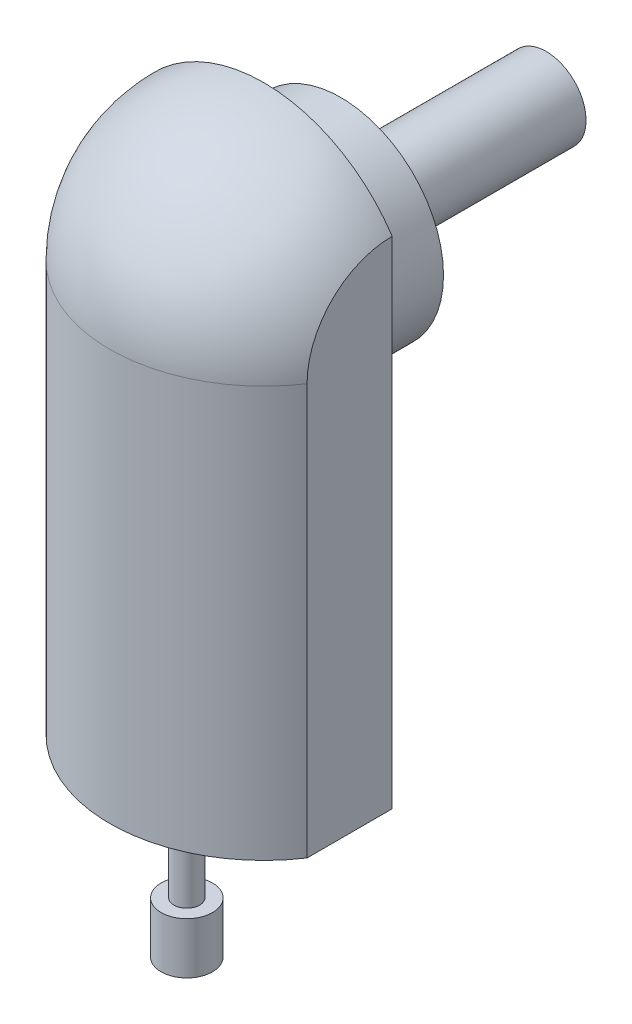
from build123d import *

# Parameters (mm, degrees)
SKETCH1_R           = 50.8
BOSS_EXTRUDE1_DEPTH = 38.1
REVOLVE1_ANGLE      = 180
BOSS_EXTRUDE2_DEPTH = 203.2
SKETCH5_W           = 76.2
SKETCH5_H           = 279.4
CUT_EXTRUDE1_DEPTH  = 12.7
SKETCH6_R           = 19.704792108
BOSS_EXTRUDE3_DEPTH = 101.6
SKETCH7_R           = 6.35
BOSS_EXTRUDE4_DEPTH = 50.8
SKETCH8_R           = 12.7
BOSS_EXTRUDE5_DEPTH = 25.4
CUT_EXTRUDE2_DEPTH  = 12.7


with BuildPart() as part:
    # Sketch1 → Boss-Extrude1 (new body)
    with BuildSketch(Plane.XY):
        with Locations(Location((0, 0, 0), (0, 0, 180))):
            Circle(SKETCH1_R)
    extrude(amount=BOSS_EXTRUDE1_DEPTH)

    # Sketch2 → Revolve1 (revolve)
    with BuildSketch(Plane.XY.offset(38.1)):
        with BuildLine():
            Line((0, 76.2), (0, -76.2))
            ThreePointArc((0, -76.2), (76.2, 0), (0, 76.2))
        make_face()
    revolve(axis=Axis((0, 76.2, 38.1), (0, -1, 0)), revolution_arc=REVOLVE1_ANGLE)

    # Sketch3 → Boss-Extrude2 (add)
    with BuildSketch(Plane(origin=(0, 0, 0), x_dir=(1, 0, 0), z_dir=(0, 1, 0))):
        with BuildLine():
            Line((-76.2, -38.1), (76.2, -38.1))
            ThreePointArc((76.2, -38.1), (0, -114.3), (-76.2, -38.1))
        make_face()
    extrude(amount=-BOSS_EXTRUDE2_DEPTH)

    # Sketch5 → Cut-Extrude1 (cut)
    with BuildSketch(Plane(origin=(76.2, 0, 0), x_dir=(0, 0, -1), z_dir=(1, 0, 0))):
        with Locations((-76.2, -63.5)):
            Rectangle(SKETCH5_W, SKETCH5_H)
    cut_extrude1 = extrude(amount=-CUT_EXTRUDE1_DEPTH, mode=Mode.SUBTRACT)

    # Mirror1: Cut-Extrude1 across plane
    add(cut_extrude1.mirror(Plane(origin=(0, 0, 0), x_dir=(0, 0, 1), z_dir=(1, 0, 0))), mode=Mode.SUBTRACT)

    # Sketch6 → Boss-Extrude3 (add)
    with BuildSketch(Plane(origin=(0, 0, 0), x_dir=(-1, 0, 0), z_dir=(0, 0, -1))):
        Circle(SKETCH6_R)
    extrude(amount=BOSS_EXTRUDE3_DEPTH)

    # Sketch7 → Boss-Extrude4 (add)
    with BuildSketch(Plane.XZ.offset(203.2)):
        with Locations(Location((0, 76.2, 0), (0, 0, 270))):
            Circle(SKETCH7_R)
    extrude(amount=BOSS_EXTRUDE4_DEPTH)

    # Sketch8 → Boss-Extrude5 (add)
    with BuildSketch(Plane.XZ.offset(254)):
        with Locations(Location((0, 76.2, 0), (0, 0, 270))):
            Circle(SKETCH8_R)
    extrude(amount=BOSS_EXTRUDE5_DEPTH)

    # Sketch9 → Cut-Extrude2 (cut)
    with BuildSketch(Plane.XZ.offset(279.4)):
        with BuildLine():
            Line((0, 83.631744278), (0, 85.853587437))
            ThreePointArc((0, 85.853587437), (-4.437705251, 84.773127931), (-7.882046977, 81.773606182))
            Line((-7.882046977, 81.773606182), (-6.067936702, 80.490800298))
            ThreePointArc((-6.067936702, 80.490800298), (-3.416335204, 82.799960363), (0, 83.631744278))
        make_face()
        with BuildLine():
            Line((6.067936702, 80.490800298), (7.882046977, 81.773606182))
            ThreePointArc((7.882046977, 81.773606182), (9.608703215, 77.129824142), (8.804494423, 72.241132945))
            Line((8.804494423, 72.241132945), (6.778076179, 73.152294908))
            ThreePointArc((6.778076179, 73.152294908), (7.397190485, 76.915818372), (6.067936702, 80.490800298))
        make_face()
        with BuildLine():
            Line((-6.778076179, 73.152294908), (-8.804494423, 72.241132945))
            ThreePointArc((-8.804494423, 72.241132945), (-5.242827536, 68.094168159), (0, 66.546412563))
            Line((0, 66.546412563), (0, 68.768255722))
            ThreePointArc((0, 68.768255722), (-4.036152756, 69.959784142), (-6.778076179, 73.152294908))
        make_face()
    extrude(amount=-CUT_EXTRUDE2_DEPTH, mode=Mode.SUBTRACT)


solid = part.part
